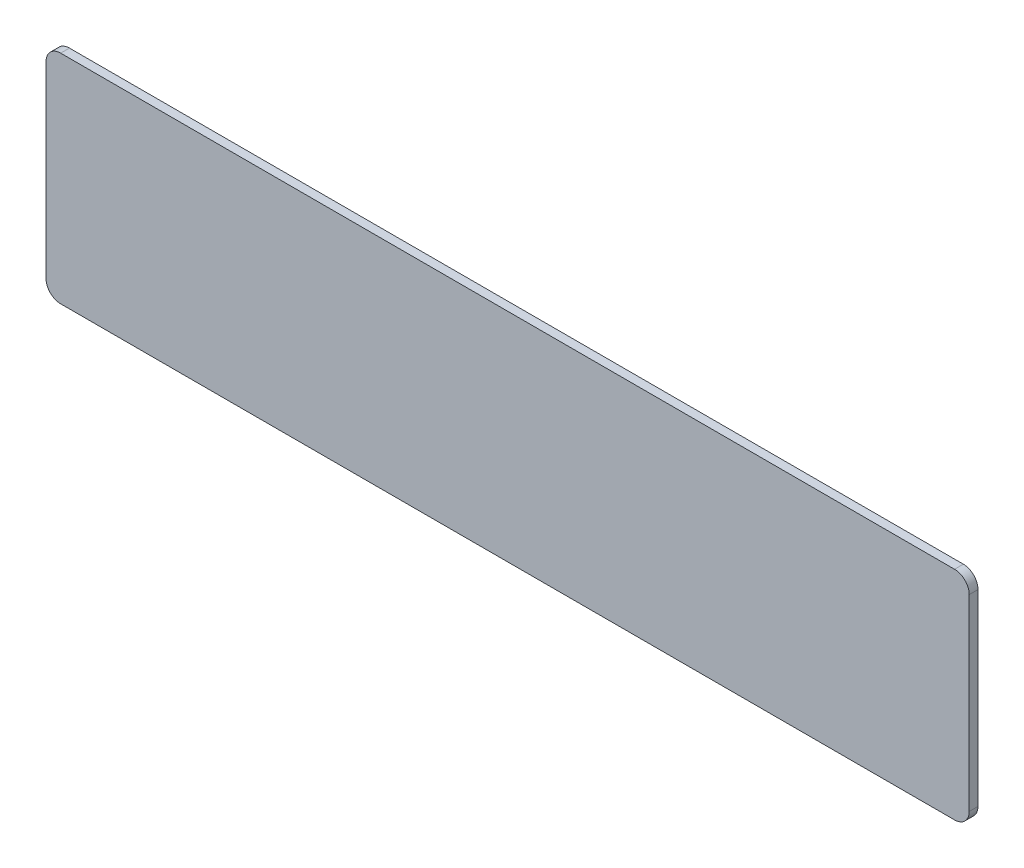
from build123d import *

# Parameters (mm, degrees)
EXTRUDE_1_DEPTH = 3


with BuildPart() as part:
    # 草图1 → 凸台-拉伸1 (new body)
    with BuildSketch(Plane.XY):
        with BuildLine():
            Line((-152.550007014, -37.050010872), (152.550007014, -37.050010872))
            ThreePointArc((152.550007014, -37.050010872), (156.08554092, -35.585544778), (157.550007014, -32.050010872))
            Line((157.550007014, -32.050010872), (157.550007014, 32.050010872))
            ThreePointArc((157.550007014, 32.050010872), (156.08554092, 35.585544778), (152.550007014, 37.050010872))
            Line((152.550007014, 37.050010872), (-152.550007014, 37.050010872))
            ThreePointArc((-152.550007014, 37.050010872), (-156.08554092, 35.585544778), (-157.550007014, 32.050010872))
            Line((-157.550007014, 32.050010872), (-157.550007014, -32.050010872))
            ThreePointArc((-157.550007014, -32.050010872), (-156.08554092, -35.585544778), (-152.550007014, -37.050010872))
        make_face()
    extrude(amount=EXTRUDE_1_DEPTH)


solid = part.part
